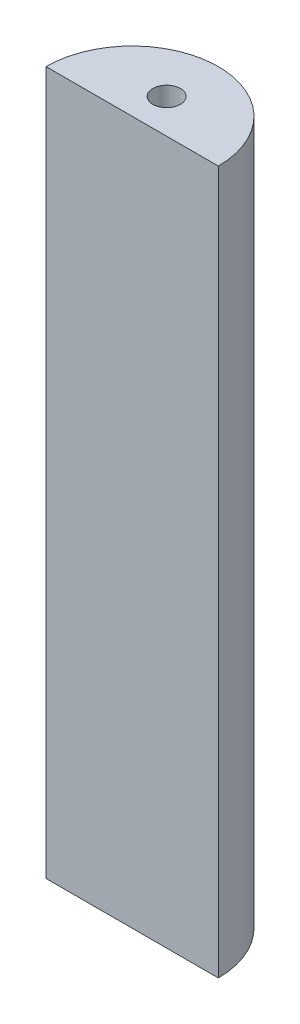
from build123d import *

# Parameters (mm, degrees)
IZIM2_R                     = 1
Y_KSEKLIK_EKSTR_ZYON1_DEPTH = 51


with BuildPart() as part:
    # Çizim2 → Yükseklik-Ekstrüzyon1 (new body)
    with BuildSketch(Plane(origin=(0, 0, 0), x_dir=(1, 0, 0), z_dir=(0, 1, 0))):
        with BuildLine():
            Line((-6.25, 0), (6.25, 0))
            ThreePointArc((6.25, 0), (0, 6.25), (-6.25, 0))
        make_face()
        with Locations(Location((0, 2.5, 0), (0, 0, 270))):
            Circle(IZIM2_R, mode=Mode.SUBTRACT)
    extrude(amount=Y_KSEKLIK_EKSTR_ZYON1_DEPTH)


solid = part.part
